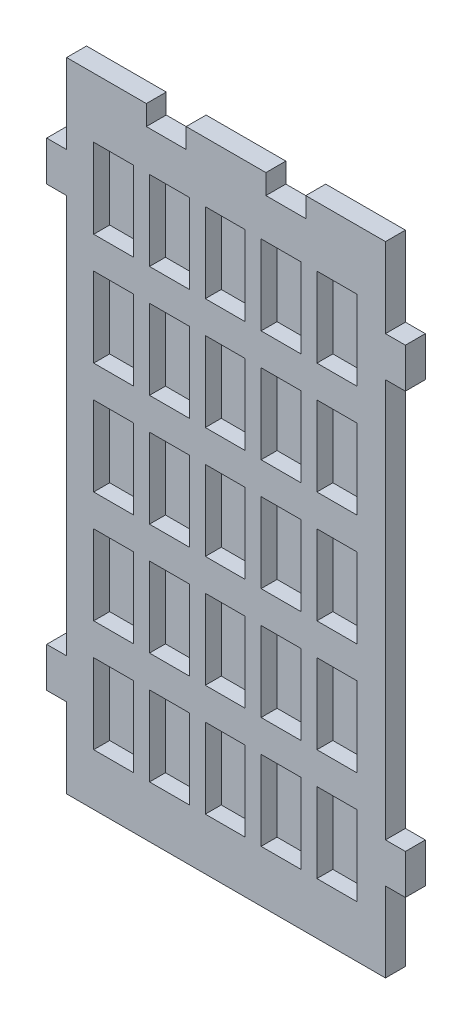
from build123d import *

# Parameters (mm, degrees)
BOSS_EXTRUDE1_DEPTH  = 3.175
SKETCH2_W            = 6.35
SKETCH2_H            = 12.7
CUT_EXTRUDE1_DEPTH   = 2.54
LPATTERN1_COUNT      = 5
LPATTERN1_PITCH      = 8.89
LPATTERN1_COUNT_DIR2 = 5
LPATTERN1_PITCH_DIR2 = 17.78


with BuildPart() as part:
    # Sketch1 → Boss-Extrude1 (new body)
    with BuildSketch(Plane.XY):
        Polygon((31.75, 0), (19.05, 0), (19.05, -3.175), (12.7, -3.175), (12.7, 0), (0, 0), (0, -12.7), (-3.175, -12.7), (-3.175, -19.05), (0, -19.05), (0, -82.55), (-3.175, -82.55), (-3.175, -88.9), (0, -88.9), (0, -101.6), (12.7, -101.6), (50.8, -101.6), (50.8, -88.9), (53.975, -88.9), (53.975, -82.55), (50.8, -82.55), (50.8, -19.05), (53.975, -19.05), (53.975, -12.7), (50.8, -12.7), (50.8, 0), (38.1, 0), (38.1, -3.175), (31.75, -3.175), align=None)
    extrude(amount=BOSS_EXTRUDE1_DEPTH)

    # Sketch2 → Cut-Extrude1 (cut)
    with BuildSketch(Plane.XY.offset(3.175)):
        with Locations((7.493, -15.875)):
            Rectangle(SKETCH2_W, SKETCH2_H)
    cut_extrude1 = extrude(amount=-CUT_EXTRUDE1_DEPTH, mode=Mode.SUBTRACT)

    # LPattern1: Cut-Extrude1 5 × 5
    with Locations(*[(i * LPATTERN1_PITCH, -j * LPATTERN1_PITCH_DIR2, 0) for i in range(LPATTERN1_COUNT) for j in range(LPATTERN1_COUNT_DIR2) if (i, j) != (0, 0)]):
        add(cut_extrude1, mode=Mode.SUBTRACT)


solid = part.part
